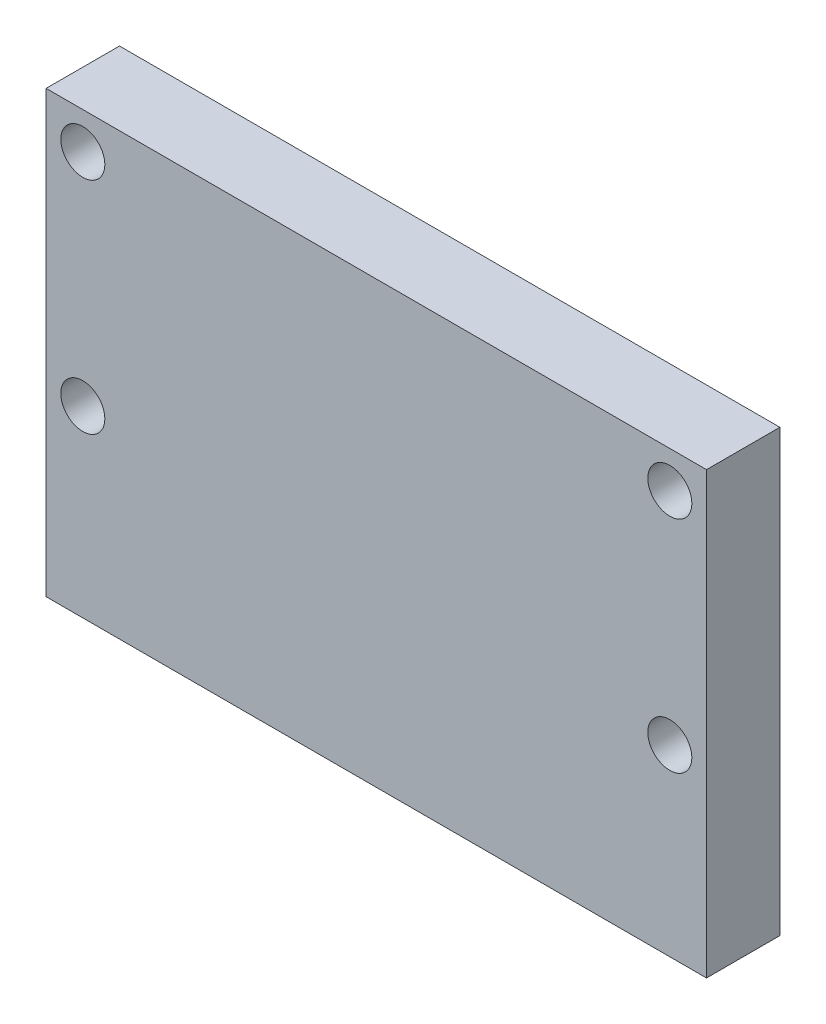
from build123d import *

# Parameters (mm, degrees)
SKETCH1_R           = 1.5
BOSS_EXTRUDE2_DEPTH = 5


with BuildPart() as part:
    # Sketch1 → Boss-Extrude2 (new body)
    with BuildSketch(Plane.XY):
        Polygon((-22.5, 10), (22.5, 10), (22.5, -10), (22.5, -20), (-22.5, -20), (-22.5, -10), align=None)
        with Locations((-20, 7.5)):
            Circle(SKETCH1_R, mode=Mode.SUBTRACT)
        with Locations((-20, -7.5)):
            Circle(SKETCH1_R, mode=Mode.SUBTRACT)
        with Locations((20, 7.5)):
            Circle(SKETCH1_R, mode=Mode.SUBTRACT)
        with Locations((20, -7.5)):
            Circle(SKETCH1_R, mode=Mode.SUBTRACT)
    extrude(amount=BOSS_EXTRUDE2_DEPTH)


solid = part.part
